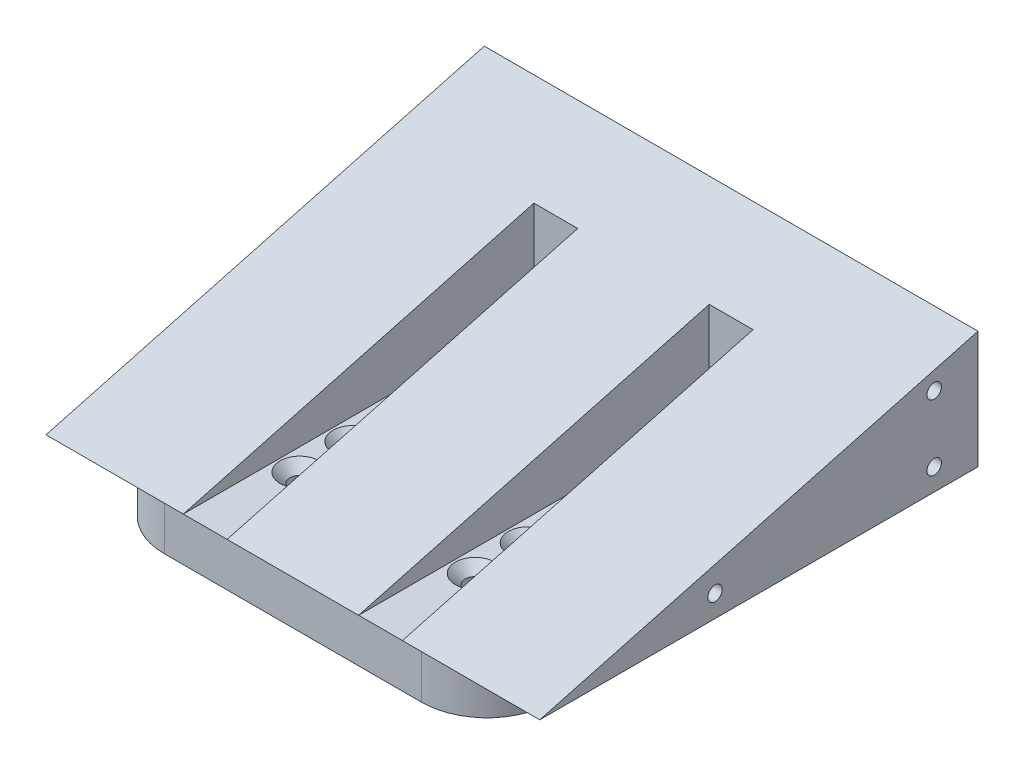
from build123d import *

# Parameters (mm, degrees)
BOSS_EXTRUDE1_DEPTH            = 112.65
M4X0_7_TAPPED_HOLE1_AT_2_COUNT = 2
M4X0_7_TAPPED_HOLE1_AT_2_PITCH = 50
M4X0_7_TAPPED_HOLE1_AT_3_COUNT = 2
M4X0_7_TAPPED_HOLE1_AT_3_PITCH = 52.201532545
SKETCH7_W                      = 10
SKETCH7_H                      = 54.452673799
CUT_EXTRUDE2_DEPTH             = 80
CSK_FOR_M4_SFHCS1_AT_2_COUNT   = 2
CSK_FOR_M4_SFHCS1_AT_2_PITCH   = 40
CSK_FOR_M4_SFHCS1_AT_3_COUNT   = 2
CSK_FOR_M4_SFHCS1_AT_3_PITCH   = 27.92
CSK_FOR_M4_SFHCS1_AT_4_COUNT   = 2
CSK_FOR_M4_SFHCS1_AT_4_PITCH   = 12.08
SKETCH11_W                     = 12
SKETCH11_H                     = 10
CUT_EXTRUDE3_DEPTH             = 156.060918939
FILLET1_R                      = 15


with BuildPart() as part:
    # Sketch1 → Boss-Extrude1 (new body)
    with BuildSketch(Plane(origin=(0, 0, 0), x_dir=(0, 0, -1), z_dir=(1, 0, 0))):
        Polygon((-50, 10), (-50, 0), (50, 0), (50, 36.794919243), align=None)
    extrude(amount=BOSS_EXTRUDE1_DEPTH)

    # Sketch5 → M4x0.7 Tapped Hole1 (revolve, cut)
    with BuildSketch(Plane(origin=(112.65, 15, 10), x_dir=(0, 0, -1), z_dir=(0, 1, 0))):
        Polygon((0, 0), (0, 11.091420021), (1.65, 10.1), (1.65, 0), align=None)
    m4x0_7_tapped_hole1 = revolve(axis=Axis((119, 15, 10), (-1, 0, 0)), mode=Mode.SUBTRACT)

    # M4x0.7 Tapped Hole1 at 2: M4x0.7 Tapped Hole1 ×2
    with Locations(*[(0, 0, -i * M4X0_7_TAPPED_HOLE1_AT_2_PITCH) for i in range(1, M4X0_7_TAPPED_HOLE1_AT_2_COUNT)]):
        add(m4x0_7_tapped_hole1, mode=Mode.SUBTRACT)

    # M4x0.7 Tapped Hole1 at 3: M4x0.7 Tapped Hole1 ×2
    with Locations(*[Vector(0, 0.28734788556634544, -0.9578262852211514) * (i * M4X0_7_TAPPED_HOLE1_AT_3_PITCH) for i in range(1, M4X0_7_TAPPED_HOLE1_AT_3_COUNT)]):
        add(m4x0_7_tapped_hole1, mode=Mode.SUBTRACT)

    # Sketch7 → Cut-Extrude2 (cut)
    with BuildSketch(Plane.XY.offset(50)):
        with Locations((76.325, 37.2263369)):
            Rectangle(SKETCH7_W, SKETCH7_H)
    cut_extrude2 = extrude(amount=-CUT_EXTRUDE2_DEPTH, mode=Mode.SUBTRACT)

    # Sketch10 → CSK for M4 SFHCS1 (revolve, cut)
    with BuildSketch(Plane(origin=(76.325, 10, -11.56), x_dir=(0, 0, 1), z_dir=(1, 0, 0))):
        Polygon((0, 0), (0, 11.451936393), (2.25, 10.1), (2.25, 2.23), (4.48, 0), align=None)
    csk_for_m4_sfhcs1 = revolve(axis=Axis((76.325, 16.35, -11.56), (0, -1, 0)), mode=Mode.SUBTRACT)

    # CSK for M4 SFHCS1 at 2: CSK for M4 SFHCS1 ×2
    with Locations(*[(0, 0, i * CSK_FOR_M4_SFHCS1_AT_2_PITCH) for i in range(1, CSK_FOR_M4_SFHCS1_AT_2_COUNT)]):
        add(csk_for_m4_sfhcs1, mode=Mode.SUBTRACT)

    # CSK for M4 SFHCS1 at 3: CSK for M4 SFHCS1 ×2
    with Locations(*[(0, 0, i * CSK_FOR_M4_SFHCS1_AT_3_PITCH) for i in range(1, CSK_FOR_M4_SFHCS1_AT_3_COUNT)]):
        add(csk_for_m4_sfhcs1, mode=Mode.SUBTRACT)

    # CSK for M4 SFHCS1 at 4: CSK for M4 SFHCS1 ×2
    with Locations(*[(0, 0, -i * CSK_FOR_M4_SFHCS1_AT_4_PITCH) for i in range(1, CSK_FOR_M4_SFHCS1_AT_4_COUNT)]):
        add(csk_for_m4_sfhcs1, mode=Mode.SUBTRACT)

    # Sketch11 → Cut-Extrude3 (cut, through all)
    with BuildSketch(Plane.XY.offset(50)):
        with Locations((106.65, 5)):
            Rectangle(SKETCH11_W, SKETCH11_H)
    cut_extrude3 = extrude(amount=-CUT_EXTRUDE3_DEPTH, mode=Mode.SUBTRACT)

    # Mirror1: M4x0.7 Tapped Hole1, Cut-Extrude2, CSK for M4 SFHCS1, Cut-Extrude3 across plane
    add(m4x0_7_tapped_hole1.mirror(Plane.ZY.offset(-56.325)), mode=Mode.SUBTRACT)
    add(cut_extrude2.mirror(Plane.ZY.offset(-56.325)), mode=Mode.SUBTRACT)
    add(csk_for_m4_sfhcs1.mirror(Plane.ZY.offset(-56.325)), mode=Mode.SUBTRACT)
    add(cut_extrude3.mirror(Plane.ZY.offset(-56.325)), mode=Mode.SUBTRACT)

    # Mirror1 copy 1 sketch → Mirror1 copy 1 (revolve, cut)
    with BuildSketch(Plane(origin=(0, 15, -40), x_dir=(0, 0, -1), z_dir=(0, 1, 0))):
        Polygon((0, 0), (0, -11.091420021), (1.65, -10.1), (1.65, 0), align=None)
    revolve(axis=Axis((-6.35, 15, -40), (-1, 0, 0)), mode=Mode.SUBTRACT)

    # Mirror1 copy 2 sketch → Mirror1 copy 2 (revolve, cut)
    with BuildSketch(Plane(origin=(0, 30, -40), x_dir=(0, 0, -1), z_dir=(0, 1, 0))):
        Polygon((0, 0), (0, -11.091420021), (1.65, -10.1), (1.65, 0), align=None)
    revolve(axis=Axis((-6.35, 30, -40), (-1, 0, 0)), mode=Mode.SUBTRACT)

    # Mirror1 copy 3 sketch → Mirror1 copy 3 (revolve, cut)
    with BuildSketch(Plane(origin=(36.325, 10, 28.44), x_dir=(0, 0, 1), z_dir=(-1, 0, 0))):
        Polygon((0, 0), (0, -11.451936393), (2.25, -10.1), (2.25, -2.23), (4.48, 0), align=None)
    revolve(axis=Axis((36.325, 16.35, 28.44), (0, 1, 0)), mode=Mode.SUBTRACT)

    # Mirror1 copy 4 sketch → Mirror1 copy 4 (revolve, cut)
    with BuildSketch(Plane(origin=(36.325, 10, 16.36), x_dir=(0, 0, 1), z_dir=(-1, 0, 0))):
        Polygon((0, 0), (0, -11.451936393), (2.25, -10.1), (2.25, -2.23), (4.48, 0), align=None)
    revolve(axis=Axis((36.325, 16.35, 16.36), (0, 1, 0)), mode=Mode.SUBTRACT)

    # Mirror1 copy 5 sketch → Mirror1 copy 5 (revolve, cut)
    with BuildSketch(Plane(origin=(36.325, 10, -23.64), x_dir=(0, 0, 1), z_dir=(-1, 0, 0))):
        Polygon((0, 0), (0, -11.451936393), (2.25, -10.1), (2.25, -2.23), (4.48, 0), align=None)
    revolve(axis=Axis((36.325, 16.35, -23.64), (0, 1, 0)), mode=Mode.SUBTRACT)

    # Fillet1
    fillet1_edges = [part.edges().sort_by_distance(p)[0] for p in [
        (12, 5, 50),
        (12, 5, -50),
        (100.65, 5, -50),
        (100.65, 5, 50),
    ]]
    fillet(fillet1_edges, radius=FILLET1_R)


solid = part.part
